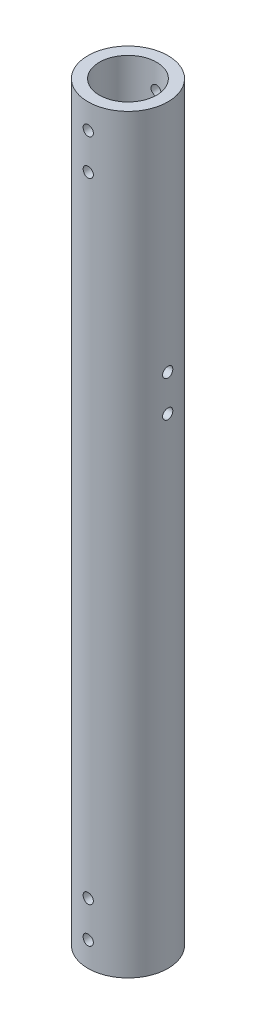
from build123d import *

# Parameters (mm, degrees)
SKETCH1_R               = 13.335
SKETCH1_R_2             = 9.525
BOSS_EXTRUDE1_DEPTH     = 250
SKETCH4_R               = 1.7
CUT_EXTRUDE1_DEPTH      = 251.710279905
CUT_EXTRUDE2_DEPTH      = 251.710280017
CUT_EXTRUDE2_DEPTH_BACK = 251.710280017
SKETCH7_R               = 1.7


with BuildPart() as part:
    # Sketch1 → Boss-Extrude1 (new body)
    with BuildSketch(Plane(origin=(0, 0, 0), x_dir=(1, 0, 0), z_dir=(0, 1, 0))):
        with Locations(Location((0, 0, 0), (0, 0, 270))):
            Circle(SKETCH1_R)
        with Locations(Location((0, 0, 0), (0, 0, 270))):
            Circle(SKETCH1_R_2, mode=Mode.SUBTRACT)
    extrude(amount=BOSS_EXTRUDE1_DEPTH)

    # Sketch4 → Cut-Extrude1 (cut, symmetric)
    with BuildSketch(Plane.XY):
        with Locations((0, 241.744231704)):
            Circle(SKETCH4_R)
        with Locations((0, 229.744231704)):
            Circle(SKETCH4_R)
    cut_extrude1 = extrude(amount=CUT_EXTRUDE1_DEPTH, both=True, mode=Mode.SUBTRACT)

    # Mirror2: Cut-Extrude1 across plane
    add(cut_extrude1.mirror(Plane.ZX.offset(125)), mode=Mode.SUBTRACT)

    # Sketch7 → Cut-Extrude2 (cut, two sides: drawn at the far end of the back side and taken through both)
    with BuildSketch(Plane(origin=(0, 0, 0), x_dir=(0, 0, -1), z_dir=(1, 0, 0)).offset(-CUT_EXTRUDE2_DEPTH_BACK)):
        with Locations((0, 160.005768296)):
            Circle(SKETCH7_R)
        with Locations((0, 172.005768296)):
            Circle(SKETCH7_R)
    extrude(amount=CUT_EXTRUDE2_DEPTH + CUT_EXTRUDE2_DEPTH_BACK, mode=Mode.SUBTRACT)


solid = part.part
